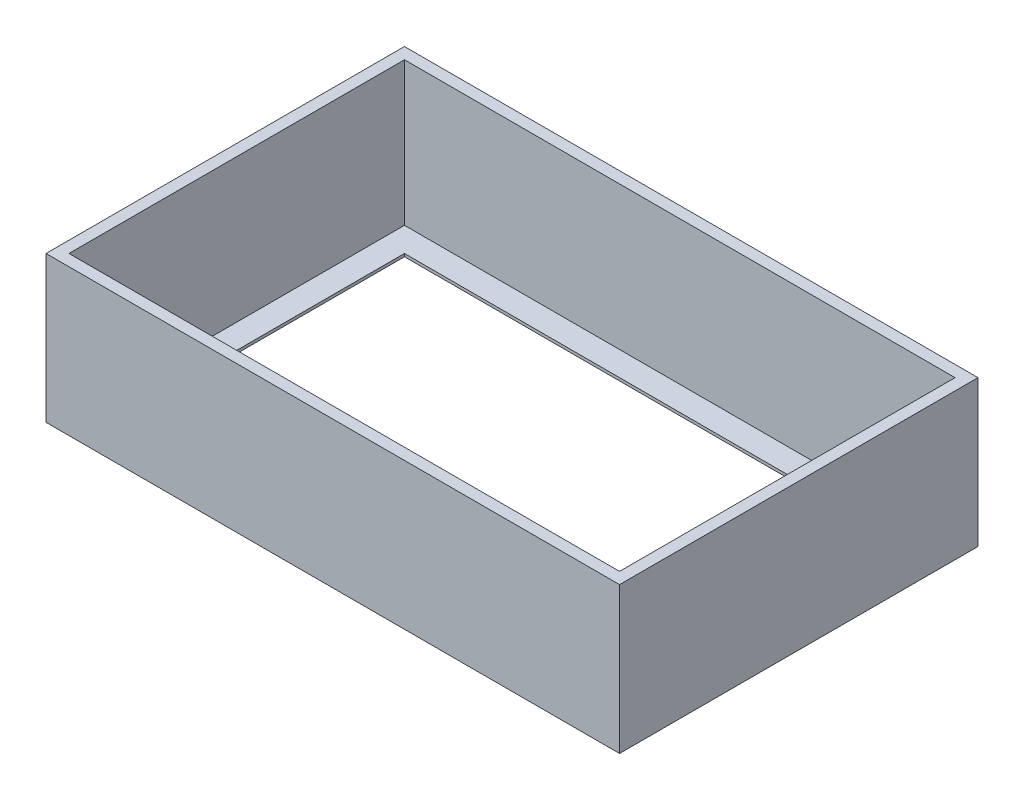
from build123d import *

# Parameters (mm, degrees)
SKETCH1_W           = 80
SKETCH1_H           = 50
BOSS_EXTRUDE1_DEPTH = 0.4
SKETCH2_W           = 80
SKETCH2_H           = 50
SKETCH2_W_2         = 76.8
SKETCH2_H_2         = 46.8
BOSS_EXTRUDE2_DEPTH = 20
SKETCH3_W           = 70
SKETCH3_H           = 40
CUT_EXTRUDE1_DEPTH  = 98.729539691


with BuildPart() as part:
    # Sketch1 → Boss-Extrude1 (new body)
    with BuildSketch(Plane(origin=(0, 0, 0), x_dir=(1, 0, 0), z_dir=(0, 1, 0))):
        with Locations((40.973770478, -25.775500222)):
            Rectangle(SKETCH1_W, SKETCH1_H)
    extrude(amount=BOSS_EXTRUDE1_DEPTH)

    # Sketch2 → Boss-Extrude2 (add)
    with BuildSketch(Plane(origin=(0, 0.4, 0), x_dir=(1, 0, 0), z_dir=(0, 1, 0))):
        with Locations((40.973770478, -25.775500222)):
            Rectangle(SKETCH2_W, SKETCH2_H)
        with Locations((40.973770478, -25.775500222)):
            Rectangle(SKETCH2_W_2, SKETCH2_H_2, mode=Mode.SUBTRACT)
    extrude(amount=BOSS_EXTRUDE2_DEPTH)

    # Sketch3 → Cut-Extrude1 (cut, through all)
    with BuildSketch(Plane(origin=(0, 0, 0), x_dir=(-1, 0, 0), z_dir=(0, -1, 0))):
        with Locations((-40.973770478, -25.775500222)):
            Rectangle(SKETCH3_W, SKETCH3_H)
    extrude(amount=-CUT_EXTRUDE1_DEPTH, mode=Mode.SUBTRACT)


solid = part.part
